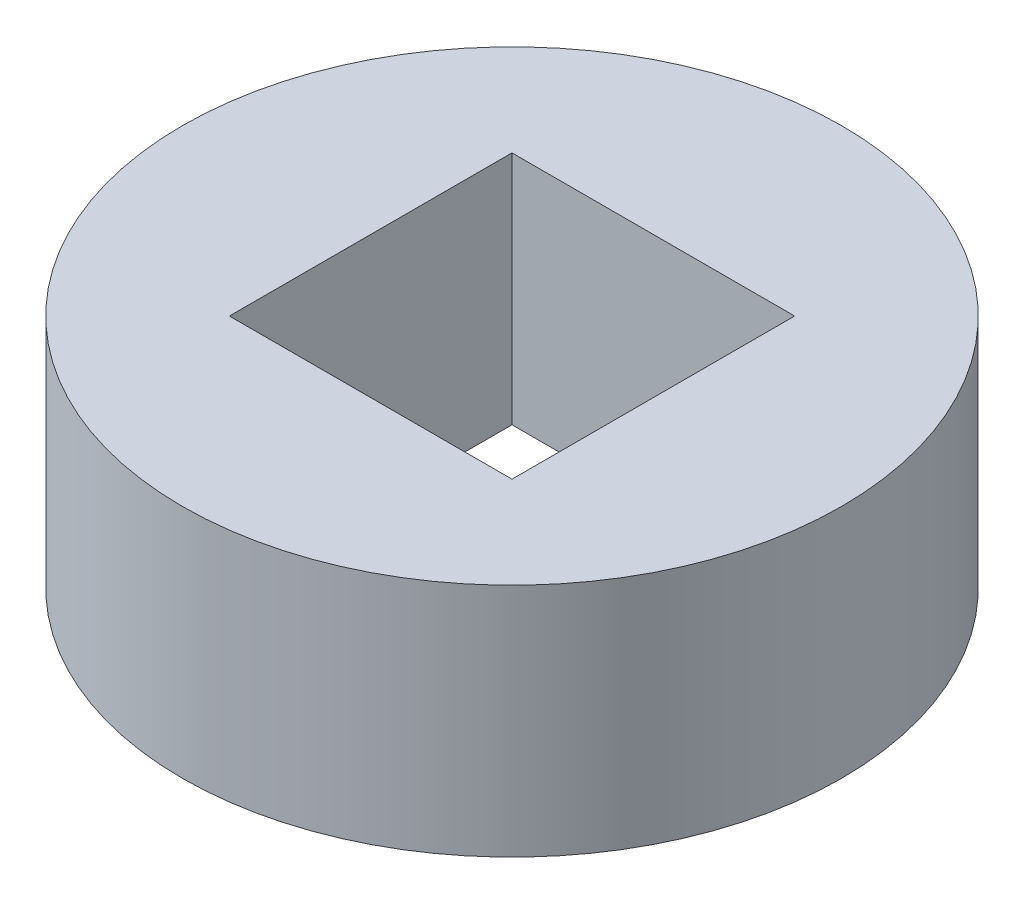
from build123d import *

# Parameters (mm, degrees)
SKETCH1_R           = 7
SKETCH1_W           = 6
SKETCH1_H           = 6
BOSS_EXTRUDE1_DEPTH = 5


with BuildPart() as part:
    # Sketch1 → Boss-Extrude1 (new body)
    with BuildSketch(Plane(origin=(0, 0, 0), x_dir=(1, 0, 0), z_dir=(0, 1, 0))):
        with Locations(Location((0, 0, 0), (0, 0, 270))):
            Circle(SKETCH1_R)
        Rectangle(SKETCH1_W, SKETCH1_H, mode=Mode.SUBTRACT)
    extrude(amount=BOSS_EXTRUDE1_DEPTH)


solid = part.part
